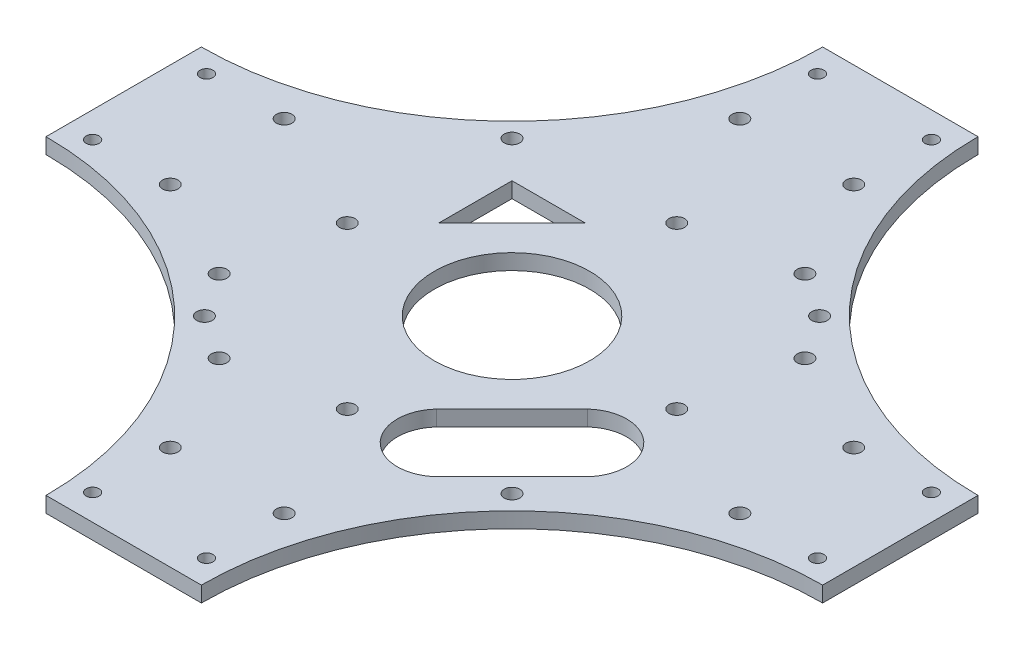
from build123d import *

# Parameters (mm, degrees)
SKETCH_1_R           = 1.25
EXTRUDE_1_DEPTH      = 3
SKETCH_2_R           = 1.5
CUT_EXTRUDE_1_DEPTH  = 3
CUT_EXTRUDE_2_DEPTH  = 3
CUT_EXTRUDE_3_DEPTH  = 3
CUT_EXTRUDE_4_DEPTH  = 10
SKETCH_6_R           = 1.5
CUT_EXTRUDE_5_DEPTH  = 10
SKETCH_7_R           = 1.5
CUT_EXTRUDE_8_DEPTH  = 10
SKETCH_8_R           = 1.5
CUT_EXTRUDE_9_DEPTH  = 10
SKETCH_9_R           = 15
CUT_EXTRUDE_10_DEPTH = 10


with BuildPart() as part:
    # 草图1 → 凸台-拉伸1 (new body)
    # profile 1 of 4: a face of its own
    with BuildSketch(Plane(origin=(0, 0, 0), x_dir=(1, 0, 0), z_dir=(0, 1, 0))):
        with BuildLine():
            ThreePointArc((75, -15), (32.573593129, -32.573593129), (15, -75))
            Line((15, -75), (0, -75))
            Line((0, -75), (0, 0))
            Line((0, 0), (75, 0))
            Line((75, 0), (75, -15))
        make_face()
        with Locations(Location((11, -70, 0), (0, 0, 270))):
            Circle(SKETCH_1_R, mode=Mode.SUBTRACT)
        with Locations(Location((70, -11, 0), (0, 0, 270))):
            Circle(SKETCH_1_R, mode=Mode.SUBTRACT)
    # profile 2 of 4: a face of its own
    with BuildSketch(Plane(origin=(0, 0, 0), x_dir=(1, 0, 0), z_dir=(0, 1, 0))):
        with BuildLine():
            ThreePointArc((-15, -75), (-32.573593129, -32.573593129), (-75, -15))
            Line((-75, -15), (-75, 0))
            Line((-75, 0), (0, 0))
            Line((0, 0), (0, -75))
            Line((0, -75), (-15, -75))
        make_face()
        with Locations(Location((-70, -11, 0), (0, 0, 270))):
            Circle(SKETCH_1_R, mode=Mode.SUBTRACT)
        with Locations(Location((-11, -70, 0), (0, 0, 270))):
            Circle(SKETCH_1_R, mode=Mode.SUBTRACT)
    # profile 3 of 4: a face of its own
    with BuildSketch(Plane(origin=(0, 0, 0), x_dir=(1, 0, 0), z_dir=(0, 1, 0))):
        with BuildLine():
            ThreePointArc((-75, 15), (-32.573593129, 32.573593129), (-15, 75))
            Line((-15, 75), (0, 75))
            Line((0, 75), (0, 0))
            Line((0, 0), (-75, 0))
            Line((-75, 0), (-75, 15))
        make_face()
        with Locations(Location((-11, 70, 0), (0, 0, 270))):
            Circle(SKETCH_1_R, mode=Mode.SUBTRACT)
        with Locations(Location((-70, 11, 0), (0, 0, 270))):
            Circle(SKETCH_1_R, mode=Mode.SUBTRACT)
    # profile 4 of 4: a face of its own
    with BuildSketch(Plane(origin=(0, 0, 0), x_dir=(1, 0, 0), z_dir=(0, 1, 0))):
        with BuildLine():
            ThreePointArc((15, 75), (32.573593129, 32.573593129), (75, 15))
            Line((75, 15), (75, 0))
            Line((75, 0), (0, 0))
            Line((0, 0), (0, 75))
            Line((0, 75), (15, 75))
        make_face()
        with Locations(Location((70, 11, 0), (0, 0, 270))):
            Circle(SKETCH_1_R, mode=Mode.SUBTRACT)
        with Locations(Location((11, 70, 0), (0, 0, 270))):
            Circle(SKETCH_1_R, mode=Mode.SUBTRACT)
    extrude(amount=EXTRUDE_1_DEPTH)

    # 草图2 → 切除-拉伸1 (cut)
    with BuildSketch(Plane.XZ):
        with Locations(Location((0.353553391, -31.466251763, 0), (0, 0, 270))):
            Circle(SKETCH_2_R)
        with Locations(Location((31.466251763, -0.353553391, 0), (0, 0, 270))):
            Circle(SKETCH_2_R)
        with Locations(Location((-0.353553391, 31.466251763, 0), (0, 0, 90))):
            Circle(SKETCH_2_R)
        with Locations(Location((-31.466251763, 0.353553391, 0), (0, 0, 90))):
            Circle(SKETCH_2_R)
    extrude(amount=-CUT_EXTRUDE_1_DEPTH, mode=Mode.SUBTRACT)

    # 草图3 → 切除-拉伸2 (cut)
    with BuildSketch(Plane(origin=(0, 3, 0), x_dir=(1, 0, 0), z_dir=(0, 1, 0))):
        Polygon((-15.556349186, 15.556349186), (-12.02081528, 19.091883092), (-22.627416998, 22.627416998), align=None)
        Polygon((-19.091883092, 12.02081528), (-15.556349186, 15.556349186), (-22.627416998, 22.627416998), align=None)
    extrude(amount=-CUT_EXTRUDE_2_DEPTH, mode=Mode.SUBTRACT)

    # 草图4 → 切除-拉伸3 (cut)
    with BuildSketch(Plane(origin=(0, 3, 0), x_dir=(1, 0, 0), z_dir=(0, 1, 0))):
        with BuildLine():
            ThreePointArc((33.944668714, -19.80253309), (34.043922781, -8.582763971), (22.827665534, -8.285032838))
            Line((22.827665534, -8.285032838), (15.556349186, -15.556349186))
            Line((15.556349186, -15.556349186), (8.285032838, -22.827665534))
            ThreePointArc((8.285032838, -22.827665534), (8.582763971, -34.043922781), (19.80253309, -33.944668714))
            Line((19.80253309, -33.944668714), (33.944668714, -19.80253309))
        make_face()
    extrude(amount=-CUT_EXTRUDE_3_DEPTH, mode=Mode.SUBTRACT)

    # 草图5 → 切除-拉伸4 (cut)
    with BuildSketch(Plane(origin=(0, 3, 0), x_dir=(1, 0, 0), z_dir=(0, 1, 0))):
        Polygon((-22.627416998, 8.485281374), (-22.627416998, 22.627416998), (-19.091883092, 12.02081528), align=None)
        Polygon((-12.02081528, 19.091883092), (-22.627416998, 22.627416998), (-8.485281374, 22.627416998), align=None)
    extrude(amount=-CUT_EXTRUDE_4_DEPTH, mode=Mode.SUBTRACT)

    # 草图6 → 切除-拉伸5 (cut)
    with BuildSketch(Plane(origin=(0, 3, 0), x_dir=(1, 0, 0), z_dir=(0, 1, 0))):
        with Locations(Location((-35.355339059, -21.213203436, 0), (0, 0, 270))):
            Circle(SKETCH_6_R)
        with Locations(Location((-21.213203436, -35.355339059, 0), (0, 0, 270))):
            Circle(SKETCH_6_R)
        with Locations(Location((35.355339059, 21.213203436, 0), (0, 0, 270))):
            Circle(SKETCH_6_R)
        with Locations(Location((21.213203436, 35.355339059, 0), (0, 0, 270))):
            Circle(SKETCH_6_R)
    extrude(amount=-CUT_EXTRUDE_5_DEPTH, mode=Mode.SUBTRACT)

    # 草图7 → 切除-拉伸8 (cut)
    with BuildSketch(Plane(origin=(0, 3, 0), x_dir=(1, 0, 0), z_dir=(0, 1, 0))):
        with Locations(Location((-29.69848481, 29.69848481, 0), (0, 0, 270))):
            Circle(SKETCH_7_R)
        with Locations(Location((29.69848481, 29.69848481, 0), (0, 0, 270))):
            Circle(SKETCH_7_R)
        with Locations(Location((29.69848481, -29.69848481, 0), (0, 0, 270))):
            Circle(SKETCH_7_R)
        with Locations(Location((-29.69848481, -29.69848481, 0), (0, 0, 270))):
            Circle(SKETCH_7_R)
    extrude(amount=-CUT_EXTRUDE_8_DEPTH, mode=Mode.SUBTRACT)

    # 草图8 → 切除-拉伸9 (cut)
    with BuildSketch(Plane(origin=(0, 3, 0), x_dir=(1, 0, 0), z_dir=(0, 1, 0))):
        with Locations(Location((-11, 55, 0), (0, 0, 270))):
            Circle(SKETCH_8_R)
        with Locations(Location((11, 55, 0), (0, 0, 270))):
            Circle(SKETCH_8_R)
        with Locations(Location((55, 11, 0), (0, 0, 270))):
            Circle(SKETCH_8_R)
        with Locations(Location((55, -11, 0), (0, 0, 270))):
            Circle(SKETCH_8_R)
        with Locations(Location((11, -55, 0), (0, 0, 270))):
            Circle(SKETCH_8_R)
        with Locations(Location((-11, -55, 0), (0, 0, 270))):
            Circle(SKETCH_8_R)
        with Locations(Location((-55, -11, 0), (0, 0, 270))):
            Circle(SKETCH_8_R)
        with Locations(Location((-55, 11, 0), (0, 0, 270))):
            Circle(SKETCH_8_R)
    extrude(amount=-CUT_EXTRUDE_9_DEPTH, mode=Mode.SUBTRACT)

    # 草图9 → 切除-拉伸10 (cut)
    with BuildSketch(Plane(origin=(0, 3, 0), x_dir=(1, 0, 0), z_dir=(0, 1, 0))):
        with Locations(Location((0, 0, 0), (0, 0, 270))):
            Circle(SKETCH_9_R)
    extrude(amount=-CUT_EXTRUDE_10_DEPTH, mode=Mode.SUBTRACT)


solid = part.part
